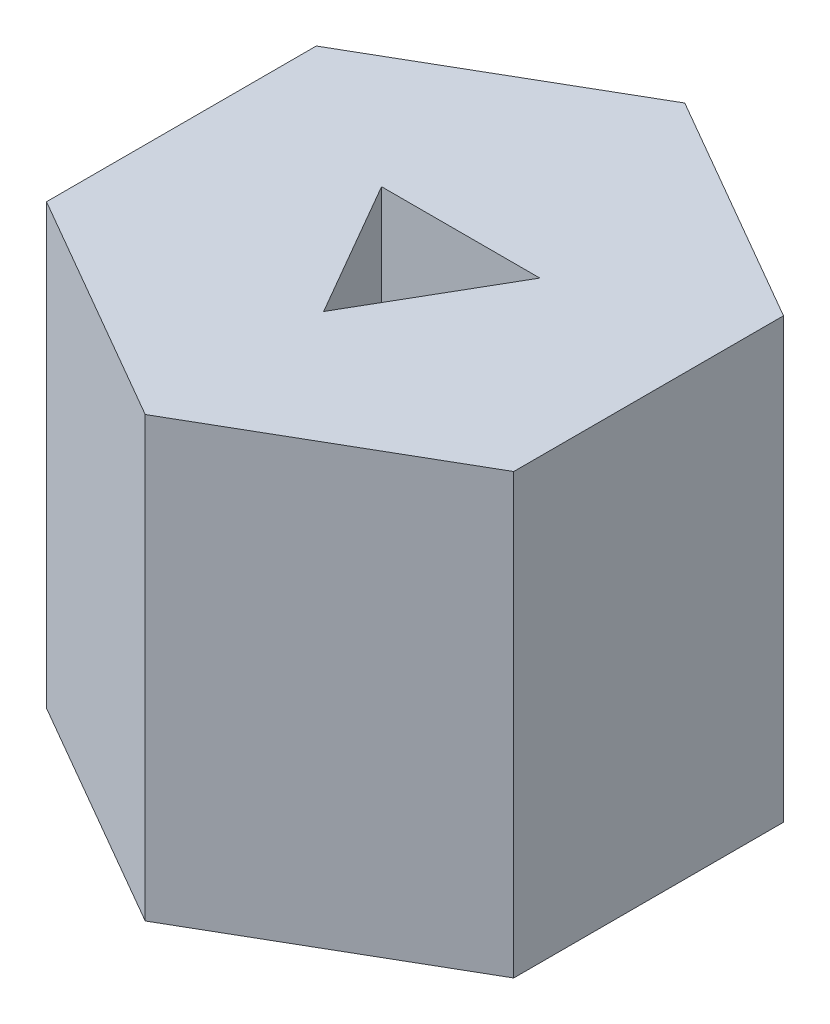
from build123d import *

# Parameters (mm, degrees)
BOSS_EXTRUDE1_DEPTH = 12
CUT_EXTRUDE1_DEPTH  = 20


with BuildPart() as part:
    # Sketch1 → Boss-Extrude1 (new body)
    with BuildSketch(Plane(origin=(0, 0, 0), x_dir=(1, 0, 0), z_dir=(0, 1, 0))):
        Polygon((0, 7.38), (-6.39126748, 3.69), (-6.39126748, -3.69), (0, -7.38), (6.39126748, -3.69), (6.39126748, 3.69), align=None)
    extrude(amount=BOSS_EXTRUDE1_DEPTH)

    # Sketch2 → Cut-Extrude1 (cut)
    with BuildSketch(Plane.XZ):
        Polygon((-2.165063509, -1.25), (2.165063509, -1.25), (0, 2.5), align=None)
    extrude(amount=-CUT_EXTRUDE1_DEPTH, mode=Mode.SUBTRACT)


solid = part.part
